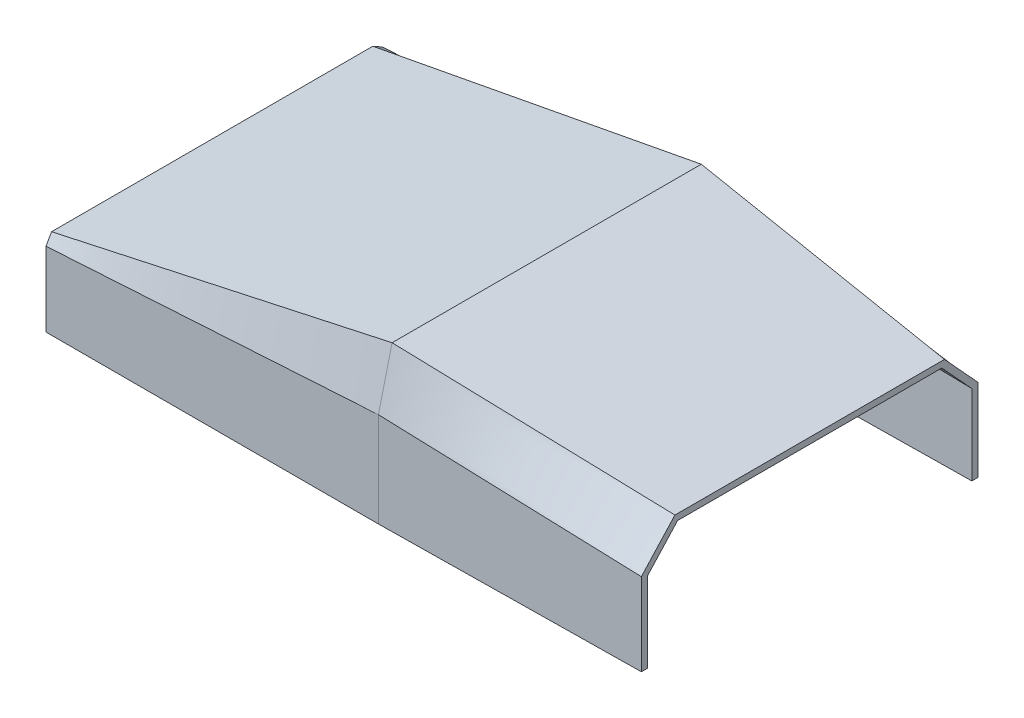
from build123d import *


with BuildPart() as part:
    # Sketch8 → Loft2 section 0
    with BuildSketch(Plane(origin=(-114.331486138, 0, -5.6121e-05), x_dir=(-4.908629793444053e-07, 0, 0.9999999999998797), z_dir=(-0.9999999999998797, 0, -4.908629793444053e-07))):
        with BuildLine():
            Line((4.180319673, 70.055915721), (7.680319673, 70.055915721))
            Line((7.680319673, 70.055915721), (7.680319673, 112.843431855))
            Line((7.680319673, 112.843431855), (10.696061863, 114.555915721))
            Line((10.696061863, 114.555915721), (187.827817904, 114.555915721))
            Line((187.827817904, 114.555915721), (192.680319673, 106.010495472))
            Line((192.680319673, 106.010495472), (192.680319673, 70.055915721))
            Line((192.680319673, 70.055915721), (196.180319673, 70.055915721))
            Line((196.180319673, 70.055915721), (196.180319673, 112.464586674))
            Line((196.180319673, 112.464586674), (193.005293366, 118.055915721))
            Line((193.005293366, 118.055915721), (9.771648721, 118.055915721))
            Line((9.771648721, 118.055915721), (4.180319673, 114.880889414))
            Line((4.180319673, 114.880889414), (4.180319673, 70.055915721))
        make_face()
    # Sketch4 → Loft2 section 1
    with BuildSketch(Plane.ZY.offset(-75.249688297)):
        with BuildLine():
            Line((7.680356611, 70.055915721), (7.680356611, 120.555915721))
            Line((7.680356611, 120.555915721), (15.50347472, 152.181098948))
            Line((15.50347472, 152.181098948), (184.857238502, 152.181098948))
            Line((184.857238502, 152.181098948), (192.680356611, 120.555915721))
            Line((192.680356611, 120.555915721), (192.680356611, 70.055915721))
            Line((192.680356611, 70.055915721), (196.180356611, 70.055915721))
            Line((196.180356611, 70.055915721), (196.180356611, 124.055915721))
            Line((196.180356611, 124.055915721), (188.357238502, 155.681098948))
            Line((188.357238502, 155.681098948), (12.00347472, 155.681098948))
            Line((12.00347472, 155.681098948), (4.180356611, 124.055915721))
            Line((4.180356611, 124.055915721), (4.180356611, 70.055915721))
            Line((4.180356611, 70.055915721), (7.680356611, 70.055915721))
        make_face()
    loft()

    # Sketch4<4> → Loft3 section 0
    with BuildSketch(Plane.ZY.offset(-75.249688297)):
        with BuildLine():
            Line((7.680356611, 70.055915721), (7.680356611, 120.555915721))
            Line((7.680356611, 120.555915721), (15.50347472, 152.181098948))
            Line((15.50347472, 152.181098948), (184.857238502, 152.181098948))
            Line((184.857238502, 152.181098948), (192.680356611, 120.555915721))
            Line((192.680356611, 120.555915721), (192.680356611, 70.055915721))
            Line((192.680356611, 70.055915721), (196.180356611, 70.055915721))
            Line((196.180356611, 70.055915721), (196.180356611, 124.055915721))
            Line((196.180356611, 124.055915721), (188.357238502, 155.681098948))
            Line((188.357238502, 155.681098948), (12.00347472, 155.681098948))
            Line((12.00347472, 155.681098948), (4.180356611, 124.055915721))
            Line((4.180356611, 124.055915721), (4.180356611, 70.055915721))
            Line((4.180356611, 70.055915721), (7.680356611, 70.055915721))
        make_face()
    # Sketch5 → Loft3 section 1
    with BuildSketch(Plane.ZY.offset(-225.249688297)):
        with BuildLine():
            Line((7.680356611, 72.055915721), (7.680356611, 117.683003445))
            Line((7.680356611, 117.683003445), (24.844432257, 136.415463658))
            Line((24.844432257, 136.415463658), (175.516280964, 136.415463658))
            Line((175.516280964, 136.415463658), (192.680356611, 117.683003445))
            Line((192.680356611, 117.683003445), (192.680356611, 72.055915721))
            Line((192.680356611, 72.055915721), (196.180356611, 72.055915721))
            Line((196.180356611, 72.055915721), (196.180356611, 119.044016942))
            Line((196.180356611, 119.044016942), (177.056382173, 139.915463658))
            Line((177.056382173, 139.915463658), (23.304331049, 139.915463658))
            Line((23.304331049, 139.915463658), (4.180356611, 119.044016942))
            Line((4.180356611, 119.044016942), (4.180356611, 72.055915721))
            Line((4.180356611, 72.055915721), (7.680356611, 72.055915721))
        make_face()
    loft()


solid = part.part
